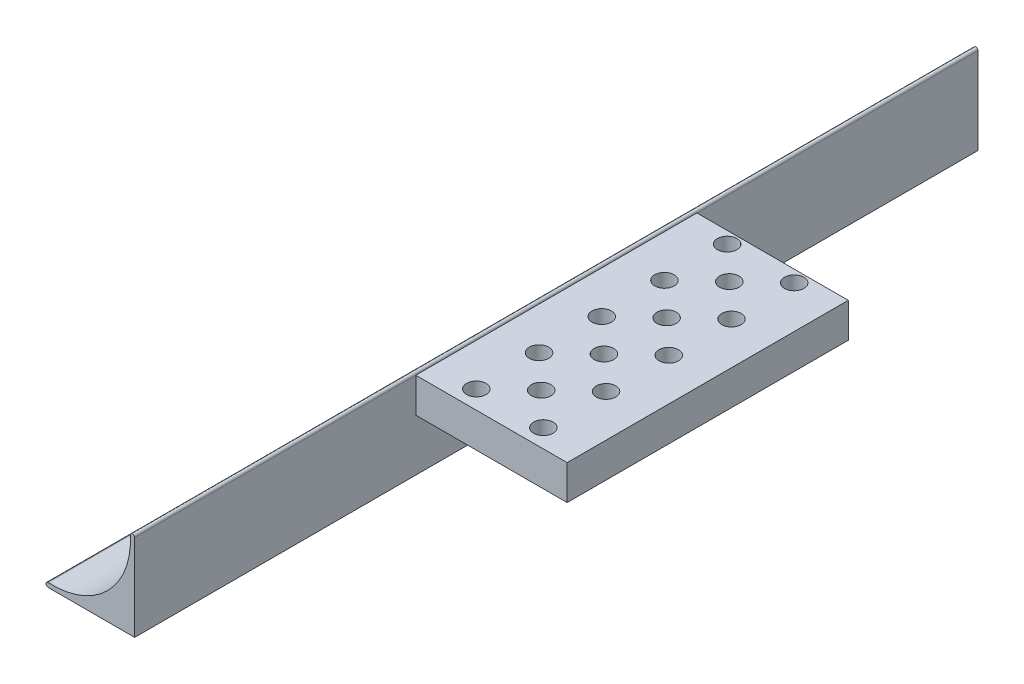
from build123d import *

# Parameters (mm, degrees)
SALIENTE_EXTRUIR1_DEPTH                = 97.5
CROQUIS2_W                             = 65
CROQUIS2_H                             = 8
SALIENTE_EXTRUIR2_DEPTH                = 35
TALADRO_DE_MARGEN_PARA_M41_D           = 4.5
TALADRO_DE_MARGEN_PARA_M41_CSINK_D     = 4.55
TALADRO_DE_MARGEN_PARA_M41_CSINK_ANGLE = 90


with BuildPart() as part:
    # Croquis1 → Saliente-Extruir1 (new, symmetric)
    with BuildSketch(Plane.XY):
        with BuildLine():
            Line((-20, 0), (0, 0))
            Line((0, 0), (0, 20))
            ThreePointArc((0, 20), (-0.513905625, 20.499806596), (-0.999226534, 19.972199507))
            ThreePointArc((-0.999226534, 19.972199507), (-6.24345971, 6.24345971), (-19.972199507, 0.999226534))
            ThreePointArc((-19.972199507, 0.999226534), (-20.499806596, 0.513905625), (-20, 0))
        make_face()
    extrude(amount=SALIENTE_EXTRUIR1_DEPTH, both=True)

    # Croquis2 → Saliente-Extruir2 (add)
    with BuildSketch(Plane(origin=(0, 0, 0), x_dir=(0, 0, -1), z_dir=(1, 0, 0))):
        with Locations((0, 16)):
            Rectangle(CROQUIS2_W, CROQUIS2_H)
    extrude(amount=SALIENTE_EXTRUIR2_DEPTH)

    # Taladro de margen para M41 (through all)
    with Locations(Plane(origin=(0, 12, 0), x_dir=(-1, 0, 0), z_dir=(0, -1, 0))):
        with Locations((-9.75, -28.25), (-25.25, -28.25), (-25.25, -13.75), (-17.5, -21), (-9.75, -13.75), (-9.75, 0.75), (-25.25, 0.75), (-17.5, -6.5), (-17.5, 8), (-9.75, 15.25), (-25.25, 15.25), (-9.75, 29.75), (-17.5, 22.5), (-25.25, 29.75)):
            CounterSinkHole(TALADRO_DE_MARGEN_PARA_M41_D / 2, TALADRO_DE_MARGEN_PARA_M41_CSINK_D / 2, counter_sink_angle=TALADRO_DE_MARGEN_PARA_M41_CSINK_ANGLE)


solid = part.part
